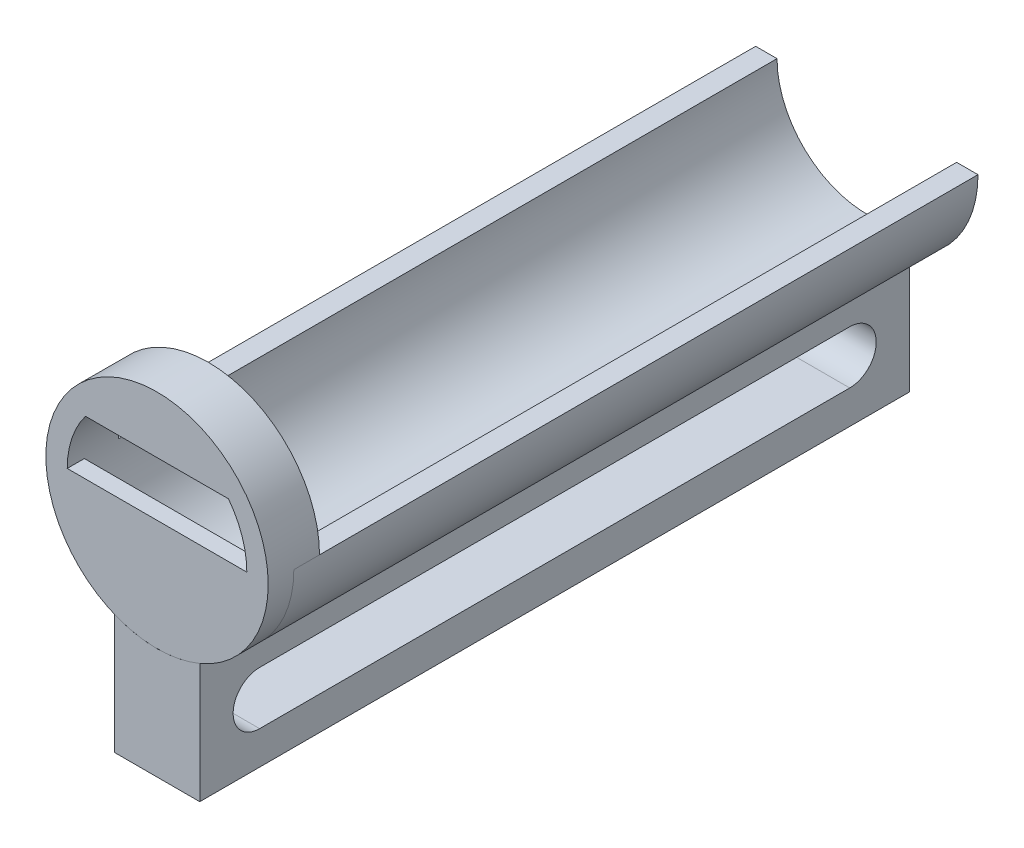
from build123d import *
from build123d.topology import SkipClean

# Parameters (mm, degrees)
SKETCH_2_R       = 13
SKETCH_2_R_2     = 10.5
EXTRUDE_1_DEPTH  = 3
EXTRUDE_START    = -2
EXTRUDE_3_DEPTH  = 2
EXTRUDE_START_2  = 80
EXTRUDE_5_DEPTH  = 80
EXTRUDE_START_3  = 3
EXTRUDE_6_DEPTH  = 3
SKETCH_7_W       = 10
SKETCH_7_H       = 83
EXTRUDE_8_DEPTH  = 26
EXTRUDE_9_DEPTH  = 18
SKETCH_9_R       = 13
EXTRUDE_10_DEPTH = 94


with BuildPart() as part:
    # 草图2 → 凸台-拉伸1 (new body)
    with BuildSketch(Plane.XY):
        with Locations((8236.969436473, 2993.613410171)):
            Circle(SKETCH_2_R)
        with Locations((8236.969436473, 2993.613410171)):
            Circle(SKETCH_2_R_2, mode=Mode.SUBTRACT)
    extrude(amount=EXTRUDE_1_DEPTH)

    # 草图3 → 凸台-拉伸3 (add)
    with BuildSketch(Plane.XY.offset(3).offset(EXTRUDE_START)):
        with BuildLine():
            Line((8247.469436473, 2993.613410171), (8226.469436473, 2993.613410171))
            ThreePointArc((8226.469436473, 2993.613410171), (8236.969436473, 2983.113410171), (8247.469436473, 2993.613410171))
        make_face()
        with BuildLine():
            Line((8228.607869965, 2999.9643318), (8245.331002981, 2999.9643318))
            ThreePointArc((8245.331002981, 2999.9643318), (8236.969436473, 3004.113410171), (8228.607869965, 2999.9643318))
        make_face()
    extrude(amount=EXTRUDE_3_DEPTH)

    # 草图5 → 凸台-拉伸5 (add)
    with BuildSketch(Plane(origin=(0, 0, 0), x_dir=(-1, 0, 0), z_dir=(0, 0, -1)).offset(EXTRUDE_START_2)):
        with BuildLine():
            Line((-8247.469436473, 2993.613410171), (-8249.968865573, 2993.613410171))
            ThreePointArc((-8249.968865573, 2993.613410171), (-8236.969436473, 2980.61398107), (-8223.970007373, 2993.613410171))
            Line((-8223.970007373, 2993.613410171), (-8226.469436473, 2993.613410171))
            ThreePointArc((-8226.469436473, 2993.613410171), (-8236.969436473, 2983.113410171), (-8247.469436473, 2993.613410171))
        make_face()
    extrude(amount=-EXTRUDE_5_DEPTH)

    # 草图6 → 凸台-拉伸6 (add)
    with SkipClean():  # the faces are left unmerged after this step: merging them gives an invalid solid
        with BuildSketch(Plane(origin=(0, 0, 0), x_dir=(-1, 0, 0), z_dir=(0, 0, -1)).offset(EXTRUDE_START_3)):
            with BuildLine():
                Line((-8249.969436473, 2993.613410171), (-8247.469436473, 2993.613410171))
                ThreePointArc((-8247.469436473, 2993.613410171), (-8236.969436473, 3004.113410171), (-8226.469436473, 2993.613410171))
                Line((-8226.469436473, 2993.613410171), (-8223.969436473, 2993.613410171))
                ThreePointArc((-8223.969436473, 2993.613410171), (-8236.969436473, 3006.613410171), (-8249.969436473, 2993.613410171))
            make_face()
        extrude(amount=-EXTRUDE_6_DEPTH)


with BuildPart() as body_2:
    # 草图7 → 凸台-拉伸8 (new body)
    with BuildSketch(Plane(origin=(0, 2993.613410171, 0), x_dir=(1, 0, 0), z_dir=(0, 1, 0))):
        with Locations((8236.969436473, 38.5)):
            Rectangle(SKETCH_7_W, SKETCH_7_H)
    extrude(amount=-EXTRUDE_8_DEPTH)


with BuildPart() as body_3:
    # 草图8 → 凸台-拉伸9 (new body)
    with BuildSketch(Plane.ZY.offset(-8231.969436473)):
        with BuildLine():
            Line((-73, 2977.713410171), (-4, 2977.713410171))
            ThreePointArc((-4, 2977.713410171), (-0.9, 2974.613410171), (-4, 2971.513410171))
            Line((-4, 2971.513410171), (-73, 2971.513410171))
            ThreePointArc((-73, 2971.513410171), (-76.1, 2974.613410171), (-73, 2977.713410171))
        make_face()
    extrude(amount=-EXTRUDE_9_DEPTH)


with BuildPart() as body_2_1:
    add(body_2.part)

    # Combine 1: cut body 3
    add(body_3.part, mode=Mode.SUBTRACT)


with BuildPart() as body_3_2:
    # 草图9 → 凸台-拉伸10 (new, symmetric)
    with BuildSketch(Plane(origin=(0, 0, -3), x_dir=(-1, 0, 0), z_dir=(0, 0, -1))):
        with Locations((-8236.969436473, 2993.613410171)):
            Circle(SKETCH_9_R)
    extrude(amount=EXTRUDE_10_DEPTH, both=True)


with BuildPart() as body_2_2:
    add(body_2_1.part)

    # Combine 2: cut body 3 2
    add(body_3_2.part, mode=Mode.SUBTRACT)


solid = Compound([part.part, body_2_2.part])
